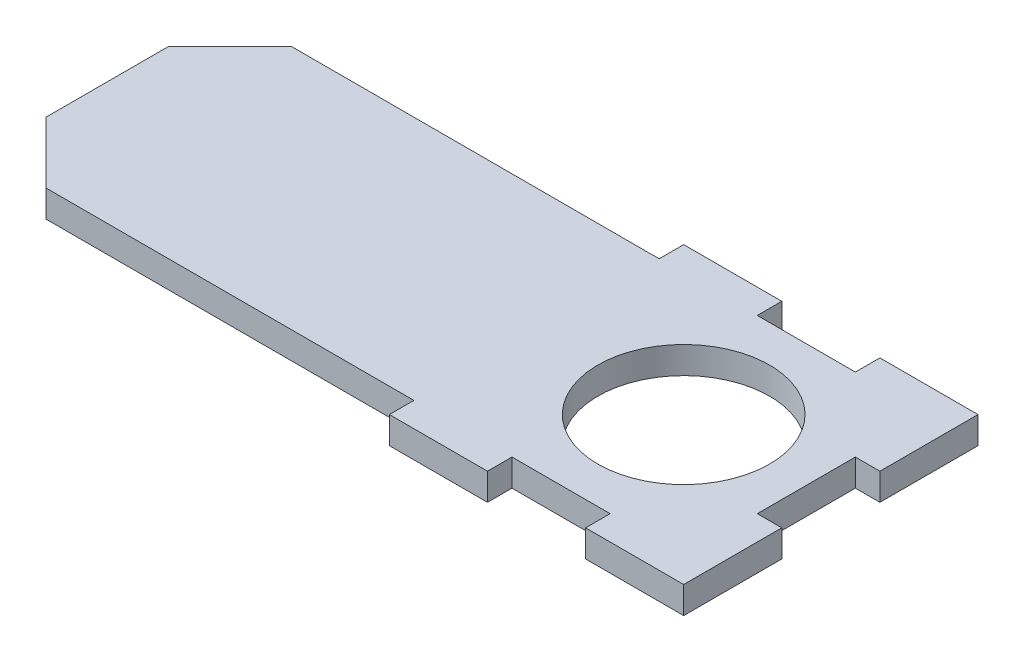
from build123d import *

# Parameters (mm, degrees)
SKETCH1_R           = 7
BOSS_EXTRUDE1_DEPTH = 2.2


with BuildPart() as part:
    # Sketch1 → Boss-Extrude1 (new body)
    with BuildSketch(Plane(origin=(0, 0, 0), x_dir=(1, 0, 0), z_dir=(0, 1, 0))):
        Polygon((-137.731808477, 3.597712716), (-137.731808477, 11.597712716), (-145.731808477, 11.597712716), (-145.731808477, 9.597712716), (-153.731808477, 9.597712716), (-153.731808477, 11.597712716), (-161.731808477, 11.597712716), (-161.731808477, 9.597712716), (-191.731808477, 9.597712716), (-196.731808477, 4.597712716), (-196.731808477, -5.402287284), (-191.731808477, -10.402287284), (-161.731808477, -10.402287284), (-161.731808477, -12.402287284), (-153.731808477, -12.402287284), (-153.731808477, -10.402287284), (-145.731808477, -10.402287284), (-145.731808477, -12.402287284), (-137.731808477, -12.402287284), (-137.731808477, -4.402287284), (-139.731808477, -4.402287284), (-139.731808477, 3.597712716), align=None)
        with Locations(Location((-149.731808477, -0.402287284, 0), (0, 0, 270))):
            Circle(SKETCH1_R, mode=Mode.SUBTRACT)
    extrude(amount=BOSS_EXTRUDE1_DEPTH)


solid = part.part
